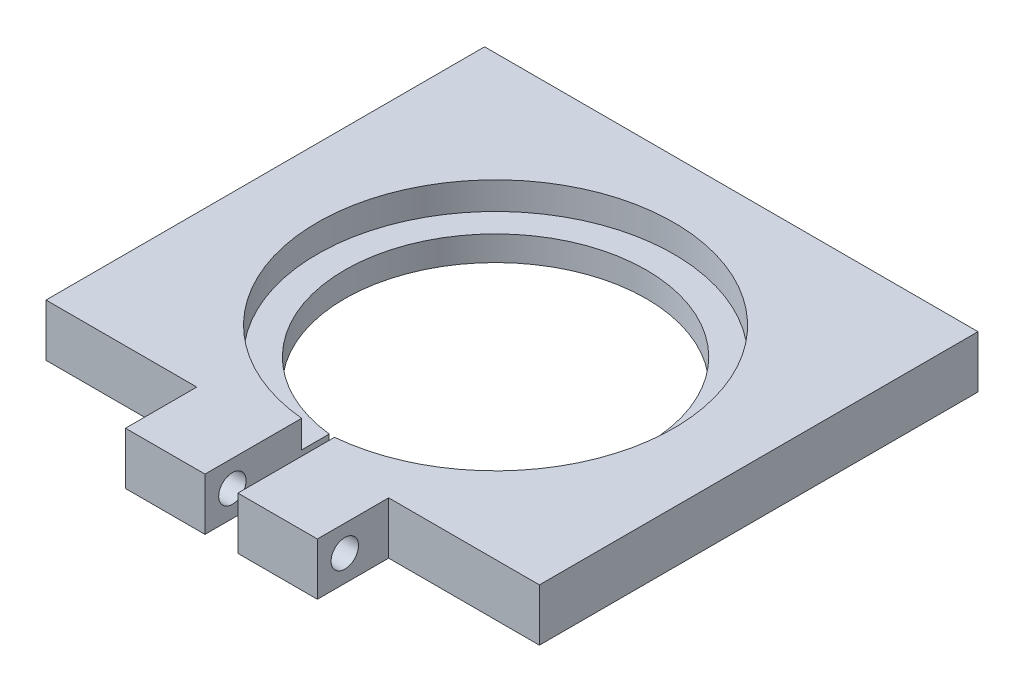
from build123d import *

# Parameters (mm, degrees)
ESBO_O1_W                = 90
ESBO_O1_H                = 93
RESSALTO_EXTRUS_O1_DEPTH = 9.53
ESBO_O3_R                = 32.51
CORTE_EXTRUS_O2_DEPTH    = 5
ESBO_O2_R                = 2.6
CORTE_EXTRUS_O1_DEPTH    = 19
CORTE_EXTRUS_O3_REACH    = 66.902
ESBO_O4_R                = 27.5
CORTE_EXTRUS_O4_REACH    = 67.407
ESBO_O5_W                = 27.5
ESBO_O5_H                = 13
CORTE_EXTRUS_O5_REACH    = 67.407
ESBO_O6_W                = 6
ESBO_O6_H                = 26.167415493
CORTE_EXTRUS_O6_REACH    = 80.481
ESBO_O7_R                = 2.5


with BuildPart() as part:
    # Esboço1 → Ressalto-extrusão1 (new body)
    with BuildSketch(Plane(origin=(0, 0, 0), x_dir=(1, 0, 0), z_dir=(0, 1, 0))):
        Rectangle(ESBO_O1_W, ESBO_O1_H)
    extrude(amount=RESSALTO_EXTRUS_O1_DEPTH)

    # Esboço3 → Corte-extrusão2 (cut)
    with BuildSketch(Plane(origin=(0, 9.53, 0), x_dir=(1, 0, 0), z_dir=(0, 1, 0))):
        with Locations(Location((0, 3.5, 0), (0, 0, 270))):
            Circle(ESBO_O3_R)
    extrude(amount=-CORTE_EXTRUS_O2_DEPTH, mode=Mode.SUBTRACT)

    # Esboço2 → Corte-extrusão1 (cut)
    with BuildSketch(Plane(origin=(0, 0, -46.5), x_dir=(-1, 0, 0), z_dir=(0, 0, -1))):
        with Locations((-40, 4.765)):
            Circle(ESBO_O2_R)
        with Locations((-25, 4.765)):
            Circle(ESBO_O2_R)
        with Locations((25, 4.76)):
            Circle(ESBO_O2_R)
        with Locations((40, 4.765)):
            Circle(ESBO_O2_R)
    extrude(amount=-CORTE_EXTRUS_O1_DEPTH, mode=Mode.SUBTRACT)

    # Esboço4 → Corte-extrusão3 (cut, up to next)
    with BuildSketch(Plane(origin=(0, 4.53, 0), x_dir=(1, 0, 0), z_dir=(0, 1, 0)), mode=Mode.PRIVATE) as corte_extrus_o3_sk1:
        with Locations(Location((0, 3.5, 0), (0, 0, 270))):
            Circle(ESBO_O4_R)
    corte_extrus_o3_tool1 = extrude(corte_extrus_o3_sk1.sketch, amount=-CORTE_EXTRUS_O3_REACH, mode=Mode.PRIVATE) & part.part
    add(corte_extrus_o3_tool1.solids().sort_by_distance((0, 4.53, -3.5))[0], mode=Mode.SUBTRACT)

    # Esboço5 → Corte-extrusão4 (cut, up to next)
    with BuildSketch(Plane(origin=(0, 9.53, 0), x_dir=(1, 0, 0), z_dir=(0, 1, 0)), mode=Mode.PRIVATE) as corte_extrus_o4_sk1:
        with Locations((31.25, -40)):
            Rectangle(ESBO_O5_W, ESBO_O5_H)
    corte_extrus_o4_tool1 = extrude(corte_extrus_o4_sk1.sketch, amount=-CORTE_EXTRUS_O4_REACH, mode=Mode.PRIVATE) & part.part
    # Esboço5 → Corte-extrusão4 (cut, up to next)
    with BuildSketch(Plane(origin=(0, 9.53, 0), x_dir=(1, 0, 0), z_dir=(0, 1, 0)), mode=Mode.PRIVATE) as corte_extrus_o4_sk2:
        with Locations((-31.25, -40)):
            Rectangle(ESBO_O5_W, ESBO_O5_H)
    corte_extrus_o4_tool2 = extrude(corte_extrus_o4_sk2.sketch, amount=-CORTE_EXTRUS_O4_REACH, mode=Mode.PRIVATE) & part.part
    add(corte_extrus_o4_tool1.solids().sort_by_distance((31.25, 9.53, 40))[0], mode=Mode.SUBTRACT)
    add(corte_extrus_o4_tool2.solids().sort_by_distance((-31.25, 9.53, 40))[0], mode=Mode.SUBTRACT)

    # Esboço6 → Corte-extrusão5 (cut, up to next)
    with BuildSketch(Plane(origin=(0, 9.53, 0), x_dir=(1, 0, 0), z_dir=(0, 1, 0)), mode=Mode.PRIVATE) as corte_extrus_o5_sk1:
        with Locations((0, -33.416292254)):
            Rectangle(ESBO_O6_W, ESBO_O6_H)
    corte_extrus_o5_tool1 = extrude(corte_extrus_o5_sk1.sketch, amount=-CORTE_EXTRUS_O5_REACH, mode=Mode.PRIVATE) & part.part
    add(corte_extrus_o5_tool1.solids().sort_by_distance((0, 9.53, 33.416292))[0], mode=Mode.SUBTRACT)

    # Corte-extrusão6: up to this face of the body (flat: up to its plane)
    corte_extrus_o6_end = Plane(part.part.faces().sort_by_distance((17.5, 4.765, 40))[0])
    # Esboço7 → Corte-extrusão6 (cut, up to the picked face)
    with BuildSketch(Plane.ZY.offset(17.5), mode=Mode.PRIVATE) as corte_extrus_o6_sk1:
        with Locations((41.5, 4.765)):
            Circle(ESBO_O7_R)
    corte_extrus_o6_tool1 = split(extrude(corte_extrus_o6_sk1.sketch, amount=-CORTE_EXTRUS_O6_REACH, mode=Mode.PRIVATE), bisect_by=corte_extrus_o6_end, keep=Keep.BOTH, mode=Mode.PRIVATE)
    add(corte_extrus_o6_tool1.solids().sort_by(Axis((-17.5, 4.765, 41.5), (1, 0, 0)))[0], mode=Mode.SUBTRACT)


solid = part.part
